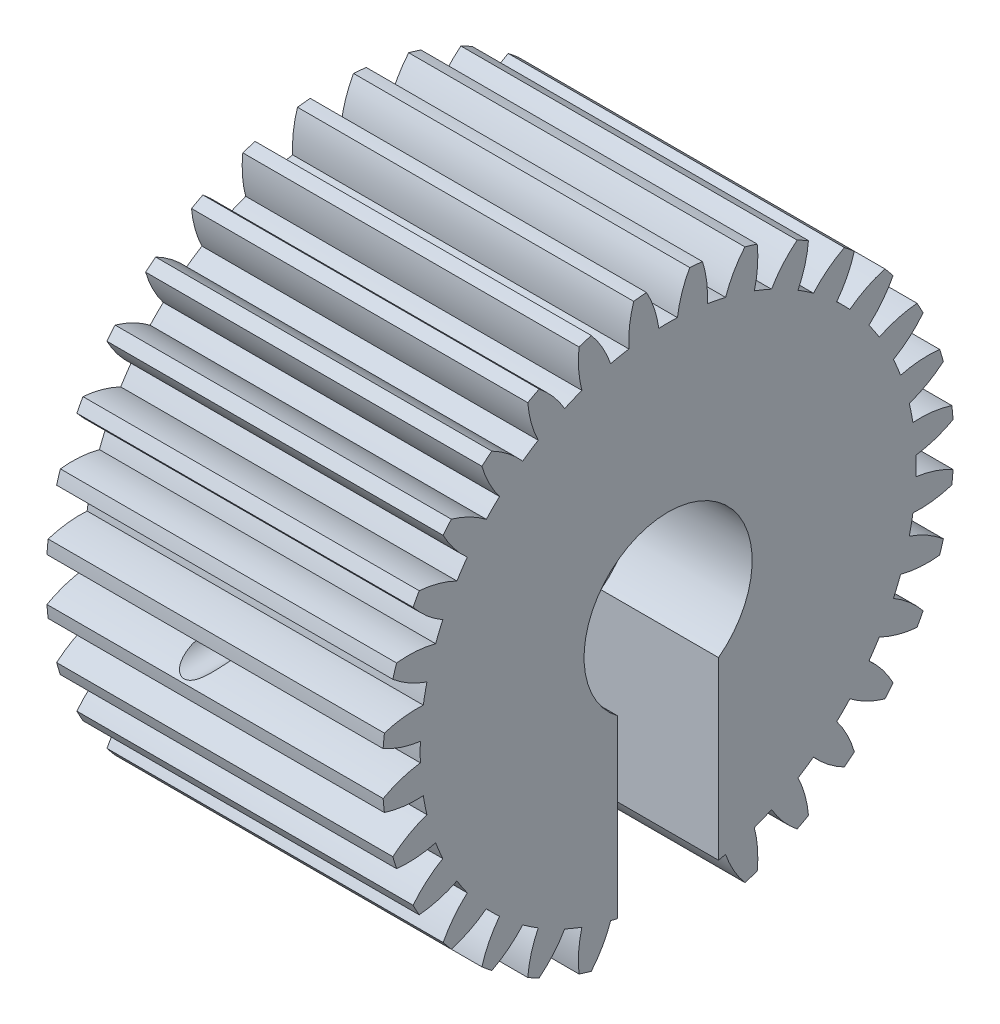
from build123d import *

# Parameters (mm, degrees)
BASPROSKE_W             = 10
BASPROSKE_H             = 8.5
TOOTHCUT_DEPTH          = 16.636495771
TEETHCUTS_COUNT         = 32
BORSKE_R                = 1
BORE_DEPTH              = 50.0000508
SKETCH1_R               = 2.5
CUT_EXTRUDE1_DEPTH      = 3.5
SKETCH2_W               = 3
SKETCH2_H               = 10
CUT_EXTRUDE2_DEPTH      = 16.610070769
CUT_EXTRUDE3_DEPTH      = 17.472745672
CUT_EXTRUDE3_DEPTH_BACK = 17.472745672
SKETCH3_R               = 0.6
SKETCH4_R               = 1.5
CUT_EXTRUDE4_DEPTH      = 6.5


with BuildPart() as part:
    # BasProSke → Base-Revolve (revolve)
    with BuildSketch(Plane(origin=(0, 0, 0), x_dir=(1, 0, 0), z_dir=(0, 1, 0))):
        with Locations((5, 4.25)):
            Rectangle(BASPROSKE_W, BASPROSKE_H)
    revolve(axis=Axis((-10, 0, 0), (1, 0, 0)))

    # TooCutSke → ToothCut (cut, through all)
    with BuildSketch(Plane(origin=(0, 0, 0), x_dir=(0, 0, -1), z_dir=(1, 0, 0))):
        with BuildLine():
            ThreePointArc((0.277002447, 7.3687954), (0, 7.374), (-0.277002447, 7.3687954))
            ThreePointArc((-0.277002447, 7.3687954), (-0.41335061, 7.952280695), (-0.656086882, 8.500117362))
            ThreePointArc((-0.656086882, 8.500117362), (0, 8.5254), (0.656086882, 8.500117362))
            ThreePointArc((0.656086882, 8.500117362), (0.41335061, 7.952280695), (0.277002447, 7.3687954))
        make_face()
    toothcut = extrude(amount=TOOTHCUT_DEPTH, mode=Mode.SUBTRACT)

    # TeethCuts: ToothCut ×32 about axis
    teethcuts_axis = Axis((-10, 0, 0), (1, 0, 0))
    for i in range(1, TEETHCUTS_COUNT):
        add(toothcut.rotate(teethcuts_axis, i * 360 / TEETHCUTS_COUNT), mode=Mode.SUBTRACT)

    # BorSke → Bore (cut, symmetric)
    with BuildSketch(Plane(origin=(0, 0, 0), x_dir=(0, 0, -1), z_dir=(1, 0, 0))):
        Circle(BORSKE_R)
    extrude(amount=BORE_DEPTH, both=True, mode=Mode.SUBTRACT)

    # Sketch1 → Cut-Extrude1 (cut)
    with BuildSketch(Plane(origin=(10, 0, 0), x_dir=(0, 0, -1), z_dir=(1, 0, 0))):
        Circle(SKETCH1_R)
    extrude(amount=-CUT_EXTRUDE1_DEPTH, mode=Mode.SUBTRACT)

    # Sketch2 → Cut-Extrude2 (cut, through all)
    with BuildSketch(Plane.ZY):
        with Locations((0, -5)):
            Rectangle(SKETCH2_W, SKETCH2_H)
    extrude(amount=-CUT_EXTRUDE2_DEPTH, mode=Mode.SUBTRACT)

    # Sketch3 → Cut-Extrude3 (cut, two sides: drawn at the far end of the back side and taken through both)
    with BuildSketch(Plane.XY.offset(-1.5).offset(-CUT_EXTRUDE3_DEPTH_BACK)):
        with Locations((4, 0)):
            Circle(SKETCH3_R)
    extrude(amount=CUT_EXTRUDE3_DEPTH + CUT_EXTRUDE3_DEPTH_BACK, mode=Mode.SUBTRACT)

    # Sketch4 → Cut-Extrude4 (cut)
    with BuildSketch(Plane.ZY):
        Circle(SKETCH4_R)
    extrude(amount=-CUT_EXTRUDE4_DEPTH, mode=Mode.SUBTRACT)


solid = part.part
